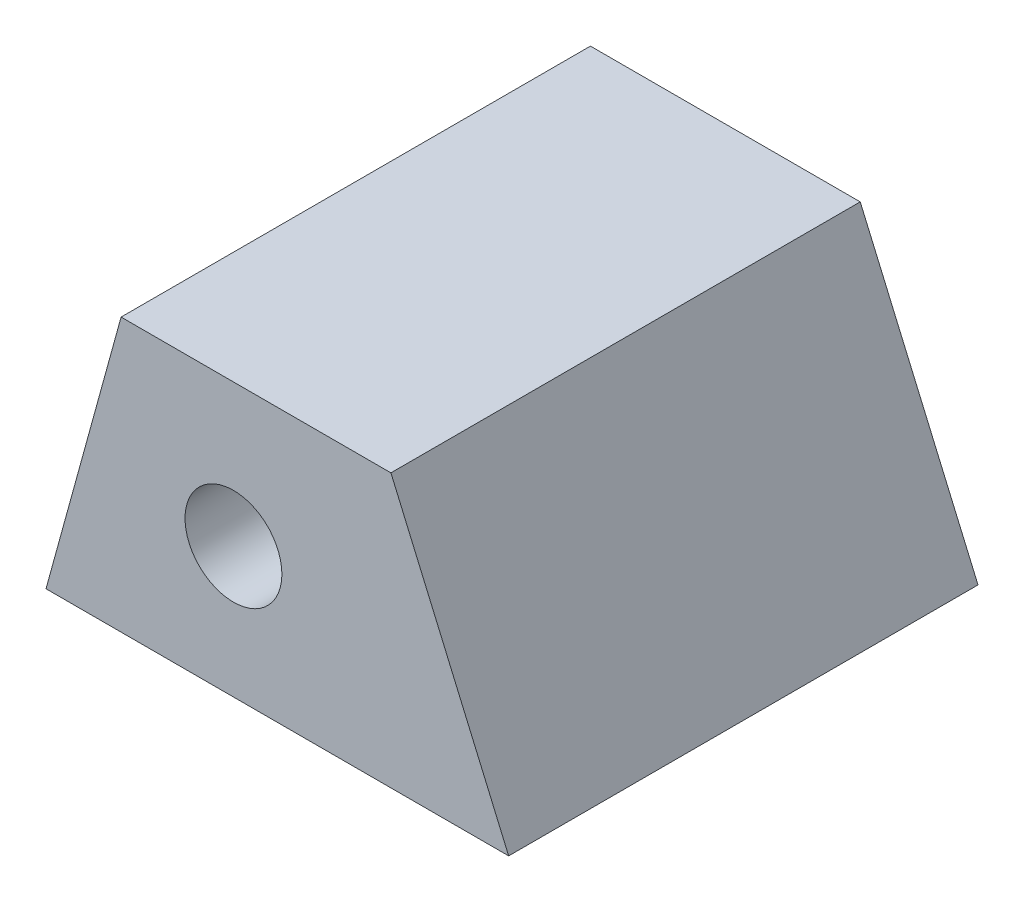
from build123d import *

# Parameters (mm, degrees)
BOSS_EXTRUDE1_DEPTH = 20
SKETCH2_R           = 2.064157156
CUT_EXTRUDE1_DEPTH  = 29


with BuildPart() as part:
    # Sketch1 → Boss-Extrude1 (new body)
    with BuildSketch(Plane.XY):
        Polygon((0, 0), (3.200053223, 11.628019174), (14.697567734, 11.628019174), (19.7161368, 0), align=None)
    extrude(amount=BOSS_EXTRUDE1_DEPTH)

    # Sketch2 → Cut-Extrude1 (cut)
    with BuildSketch(Plane.XY.offset(20)):
        with Locations((7.988238497, 5.564076228)):
            Circle(SKETCH2_R)
    extrude(amount=-CUT_EXTRUDE1_DEPTH, mode=Mode.SUBTRACT)


solid = part.part
